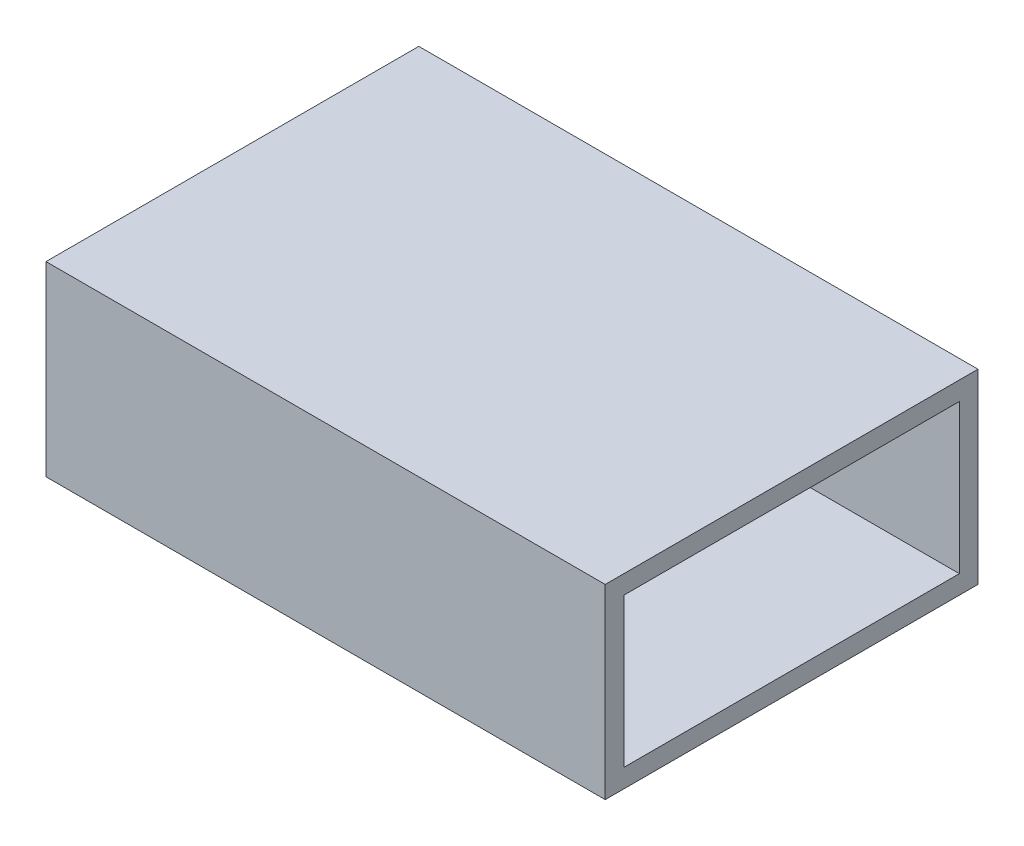
from build123d import *

# Parameters (mm, degrees)
SKETCH1_W                                 = 25.4
SKETCH1_H                                 = 50.8
SKETCH1_W_2                               = 20.32
SKETCH1_H_2                               = 45.72
VERSAFRAME_VERSAFRAME_2_X_1_X_0_1_1_DEPTH = 76.2


with BuildPart() as part:
    # Sketch1 → Versaframe VERSAFRAME 2 X 1 X 0.1 (1) (new body)
    with BuildSketch(Plane.YZ.offset(-38.1)):
        Rectangle(SKETCH1_W, SKETCH1_H)
        Rectangle(SKETCH1_W_2, SKETCH1_H_2, mode=Mode.SUBTRACT)
    extrude(amount=VERSAFRAME_VERSAFRAME_2_X_1_X_0_1_1_DEPTH)


solid = part.part
